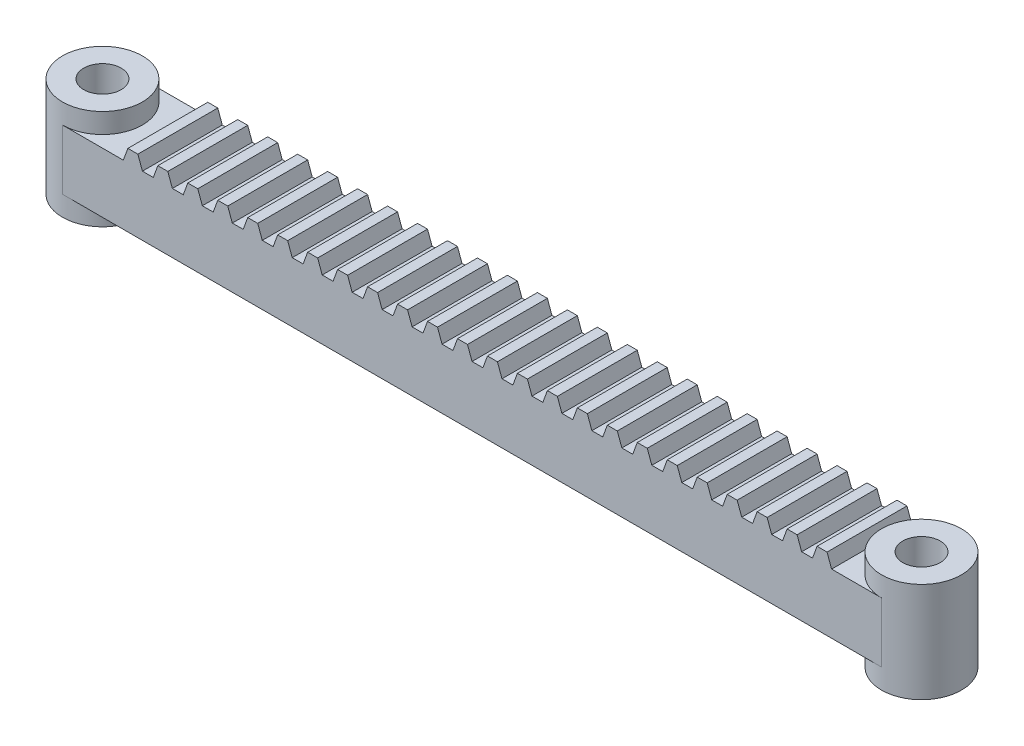
from build123d import *

# Parameters (mm, degrees)
SKETCH1_R             = 8
SKETCH1_R_2           = 3.75
BOSS_EXTRUDE1_DEPTH   = 10
BOSS_EXTRUDE1_2_DEPTH = 10
BOSS_EXTRUDE2_DEPTH   = 6
BOSS_EXTRUDE3_DEPTH   = 16
LPATTERN1_COUNT       = 24
LPATTERN1_PITCH       = 6


with BuildPart() as part:
    # Sketch1 → Boss-Extrude1 (new, symmetric)
    with BuildSketch(Plane(origin=(0, 0, 0), x_dir=(1, 0, 0), z_dir=(0, 1, 0))):
        Circle(SKETCH1_R)
        Circle(SKETCH1_R_2, mode=Mode.SUBTRACT)
    extrude(amount=BOSS_EXTRUDE1_DEPTH, both=True)



with BuildPart() as body_2:
    # Sketch1 → Boss-Extrude1 2 (new, symmetric)
    with BuildSketch(Plane(origin=(0, 0, 0), x_dir=(1, 0, 0), z_dir=(0, 1, 0))):
        with Locations((164, 0)):
            Circle(SKETCH1_R)
        with Locations((164, 0)):
            Circle(SKETCH1_R_2, mode=Mode.SUBTRACT)
    extrude(amount=BOSS_EXTRUDE1_2_DEPTH, both=True)


with BuildPart() as part_1:
    add(part.part)

    add(body_2.part)  # Boss-Extrude2 merges body 2
    # Sketch1<3> → Boss-Extrude2 (add, symmetric)
    with BuildSketch(Plane(origin=(0, 0, 0), x_dir=(1, 0, 0), z_dir=(0, 1, 0))):
        with BuildLine():
            ThreePointArc((0, 8), (8, 0), (0, -8))
            Line((0, -8), (164, -8))
            ThreePointArc((164, -8), (156, 0), (164, 8))
            Line((164, 8), (0, 8))
        make_face()
    extrude(amount=BOSS_EXTRUDE2_DEPTH, both=True)

    # Sketch2 → Boss-Extrude3 (add)
    with BuildSketch(Plane.XY.offset(8)):
        Polygon((154, 6), (153.090074414, 8.5), (151.090074414, 8.5), (150.180148829, 6), align=None)
    boss_extrude3 = extrude(amount=-BOSS_EXTRUDE3_DEPTH)

    # LPattern1: Boss-Extrude3 ×24
    with Locations(*[(-i * LPATTERN1_PITCH, 0, 0) for i in range(1, LPATTERN1_COUNT)]):
        add(boss_extrude3)


solid = part_1.part
